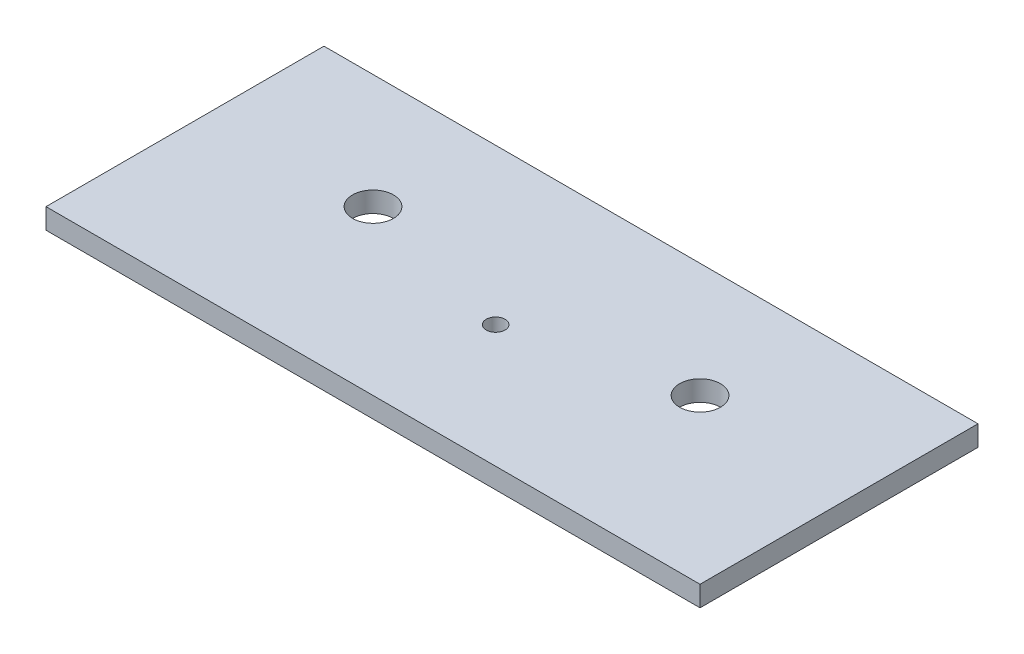
from build123d import *

# Parameters (mm, degrees)
SKETCH2_W           = 101.6
SKETCH2_H           = 43.18
SKETCH2_R           = 1.4605
SKETCH2_R_2         = 3.175
BOSS_EXTRUDE1_DEPTH = 3.175


with BuildPart() as part:
    # Sketch2 → Boss-Extrude1 (new body)
    with BuildSketch(Plane(origin=(0, 0, 0), x_dir=(1, 0, 0), z_dir=(0, 1, 0))):
        with Locations((0, -3.81)):
            Rectangle(SKETCH2_W, SKETCH2_H)
        with Locations(Location((0, -6.35, 0), (0, 0, 270))):
            Circle(SKETCH2_R, mode=Mode.SUBTRACT)
        with Locations(Location((-25.4, 0, 0), (0, 0, 270))):
            Circle(SKETCH2_R_2, mode=Mode.SUBTRACT)
        with BuildLine():
            ThreePointArc((22.225, 0), (25.4, 3.175), (28.575, 0))
            ThreePointArc((28.575, 0), (25.4, -3.175), (22.225, 0))
        make_face(mode=Mode.SUBTRACT)
    extrude(amount=BOSS_EXTRUDE1_DEPTH)


solid = part.part
